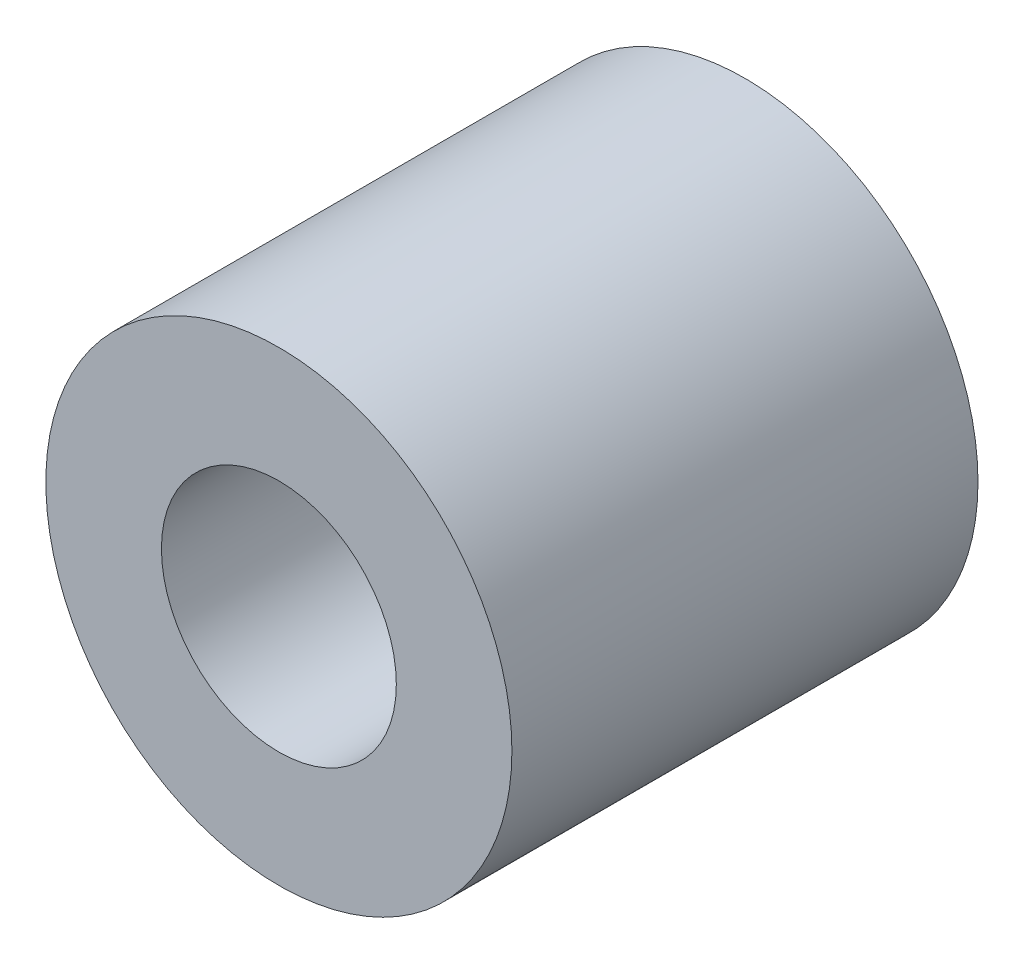
from build123d import *

# Parameters (mm, degrees)
SKETCH1_R      = 6.35
SKETCH1_R_2    = 3.2004
EXTRUDE1_DEPTH = 6.35


with BuildPart() as part:
    # Sketch1 → Extrude1 (new, symmetric)
    with BuildSketch(Plane.XY):
        Circle(SKETCH1_R)
        Circle(SKETCH1_R_2, mode=Mode.SUBTRACT)
    extrude(amount=EXTRUDE1_DEPTH, both=True)


solid = part.part
